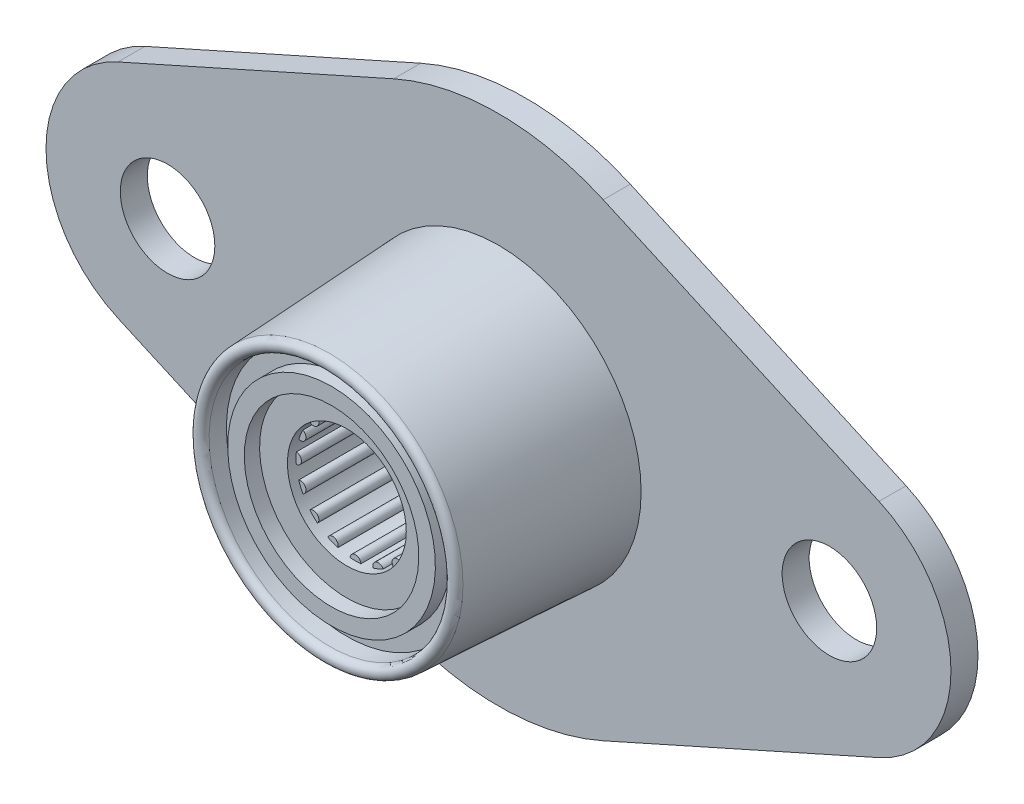
from build123d import *
from build123d.topology import SkipClean

# Parameters (mm, degrees)
SKETCH1_R          = 2.778125
SKETCH1_R_2        = 8.382
EXTRUDE1_DEPTH     = 1.5875
CUT_EXTRUDE2_DEPTH = 33.32239767
SKETCH4_R          = 3.4925
CUT_EXTRUDE3_DEPTH = 0.508
CUT_EXTRUDE4_START = -0.508
SKETCH5_R          = 3.4925
CUT_EXTRUDE4_DEPTH = 0.508


with BuildPart() as part:
    # Sketch1 → Extrude1 (new body)
    with BuildSketch(Plane.XY):
        with BuildLine():
            Line((-22.362691327, 6.521593303), (-6.155612245, 13.767808085))
            ThreePointArc((-6.155612245, 13.767808085), (0, 15.08125), (6.155612245, 13.767808085))
            Line((6.155612245, 13.767808085), (22.362691327, 6.521593303))
            ThreePointArc((22.362691327, 6.521593303), (26.590625, 0), (22.362691327, -6.521593303))
            Line((22.362691327, -6.521593303), (6.155612245, -13.767808085))
            ThreePointArc((6.155612245, -13.767808085), (0, -15.08125), (-6.155612245, -13.767808085))
            Line((-6.155612245, -13.767808085), (-22.362691327, -6.521593303))
            ThreePointArc((-22.362691327, -6.521593303), (-26.590625, 0), (-22.362691327, 6.521593303))
        make_face()
        with Locations((-19.446875, 0)):
            Circle(SKETCH1_R, mode=Mode.SUBTRACT)
        with Locations((19.446875, 0)):
            Circle(SKETCH1_R, mode=Mode.SUBTRACT)
        Circle(SKETCH1_R_2, mode=Mode.SUBTRACT)
    extrude(amount=EXTRUDE1_DEPTH)

    # Sketch2 → Revolve1 (revolve)
    with BuildSketch(Plane(origin=(0, 0, 0), x_dir=(0, 0, -1), z_dir=(1, 0, 0))):
        with BuildLine():
            Line((0, 8.382), (-1.5875, 8.382))
            Line((-1.5875, 8.382), (-11.53560961, 7.860641667))
            ThreePointArc((-11.53560961, 7.860641667), (-11.798841313, 7.73929019), (-11.90625, 7.47006819))
            ThreePointArc((-11.90625, 7.47006819), (-11.791696686, 7.193512026), (-11.515140521, 7.078958711))
            Line((-11.515140521, 7.078958711), (-10.499140521, 7.078958711))
            Line((-10.499140521, 7.078958711), (-10.499140521, 6.102969034))
            Line((-10.499140521, 6.102969034), (-11.39825, 6.102969034))
            Line((-11.39825, 6.102969034), (-11.39825, 5.126979356))
            Line((-11.39825, 5.126979356), (-10.499140521, 5.126979356))
            Line((-10.499140521, 5.126979356), (-10.499140521, 4.150989678))
            Line((-10.499140521, 4.150989678), (-10.499140521, 3.175))
            Line((-10.499140521, 3.175), (0, 3.175))
            Line((0, 3.175), (0, 8.382))
        make_face()
    revolve(axis=Axis((0, 0, 0), (0, 0, 1)))

    # Sketch3 → Cut-Extrude2 (cut, through all)
    with BuildSketch(Plane.XY.offset(10.499140521)):
        with BuildLine():
            ThreePointArc((-1.624027636, 3.0919396), (-1.940329039, 2.903907621), (-2.235091242, 2.683639952))
            ThreePointArc((-2.235091242, 2.683639952), (-2.24506403, 2.24506403), (-2.683639952, 2.235091242))
            ThreePointArc((-2.683639952, 2.235091242), (-2.903907621, 1.940329039), (-3.0919396, 1.624027636))
            ThreePointArc((-3.0919396, 1.624027636), (-2.933317516, 1.215019898), (-3.334692412, 1.037970504))
            ThreePointArc((-3.334692412, 1.037970504), (-3.425392592, 0.68135295), (-3.478068182, 0.317171835))
            ThreePointArc((-3.478068182, 0.317171835), (-3.175, 0), (-3.478068182, -0.317171835))
            ThreePointArc((-3.478068182, -0.317171835), (-3.425392592, -0.68135295), (-3.334692412, -1.037970504))
            ThreePointArc((-3.334692412, -1.037970504), (-2.933317516, -1.215019898), (-3.0919396, -1.624027636))
            ThreePointArc((-3.0919396, -1.624027636), (-2.903907621, -1.940329039), (-2.683639952, -2.235091242))
            ThreePointArc((-2.683639952, -2.235091242), (-2.24506403, -2.24506403), (-2.235091242, -2.683639952))
            ThreePointArc((-2.235091242, -2.683639952), (-1.940329039, -2.903907621), (-1.624027636, -3.0919396))
            ThreePointArc((-1.624027636, -3.0919396), (-1.215019898, -2.933317516), (-1.037970504, -3.334692412))
            ThreePointArc((-1.037970504, -3.334692412), (-0.68135295, -3.425392592), (-0.317171835, -3.478068182))
            ThreePointArc((-0.317171835, -3.478068182), (0, -3.175), (0.317171835, -3.478068182))
            ThreePointArc((0.317171835, -3.478068182), (0.68135295, -3.425392592), (1.037970504, -3.334692412))
            ThreePointArc((1.037970504, -3.334692412), (1.215019898, -2.933317516), (1.624027636, -3.0919396))
            ThreePointArc((1.624027636, -3.0919396), (1.940329039, -2.903907621), (2.235091242, -2.683639952))
            ThreePointArc((2.235091242, -2.683639952), (2.24506403, -2.24506403), (2.683639952, -2.235091242))
            ThreePointArc((2.683639952, -2.235091242), (2.903907621, -1.940329039), (3.0919396, -1.624027636))
            ThreePointArc((3.0919396, -1.624027636), (2.933317516, -1.215019898), (3.334692412, -1.037970504))
            ThreePointArc((3.334692412, -1.037970504), (3.425392592, -0.68135295), (3.478068182, -0.317171835))
            ThreePointArc((3.478068182, -0.317171835), (3.175, 0), (3.478068182, 0.317171835))
            ThreePointArc((3.478068182, 0.317171835), (3.425392592, 0.68135295), (3.334692412, 1.037970504))
            ThreePointArc((3.334692412, 1.037970504), (2.933317516, 1.215019898), (3.0919396, 1.624027636))
            ThreePointArc((3.0919396, 1.624027636), (2.903907621, 1.940329039), (2.683639952, 2.235091242))
            ThreePointArc((2.683639952, 2.235091242), (2.24506403, 2.24506403), (2.235091242, 2.683639952))
            ThreePointArc((2.235091242, 2.683639952), (1.940329039, 2.903907621), (1.624027636, 3.0919396))
            ThreePointArc((1.624027636, 3.0919396), (1.215019898, 2.933317516), (1.037970504, 3.334692412))
            ThreePointArc((1.037970504, 3.334692412), (0.68135295, 3.425392592), (0.317171835, 3.478068182))
            ThreePointArc((0.317171835, 3.478068182), (0, 3.175), (-0.317171835, 3.478068182))
            ThreePointArc((-0.317171835, 3.478068182), (-0.68135295, 3.425392592), (-1.037970504, 3.334692412))
            ThreePointArc((-1.037970504, 3.334692412), (-1.215019898, 2.933317516), (-1.624027636, 3.0919396))
        make_face()
    extrude(amount=-CUT_EXTRUDE2_DEPTH, mode=Mode.SUBTRACT)

    # Sketch4 → Cut-Extrude3 (cut)
    with BuildSketch(Plane.XY.offset(10.499140521)):
        Circle(SKETCH4_R)
    extrude(amount=-CUT_EXTRUDE3_DEPTH, mode=Mode.SUBTRACT)

    # Sketch5 → Cut-Extrude4 (cut)
    with SkipClean():  # the faces are left unmerged after this step: merging them gives an invalid solid
        with BuildSketch(Plane(origin=(0, 0, 0), x_dir=(-1, 0, 0), z_dir=(0, 0, -1)).offset(CUT_EXTRUDE4_START)):
            with Locations(Location((0, 0, 0), (0, 0, 180))):
                Circle(SKETCH5_R)
        extrude(amount=CUT_EXTRUDE4_DEPTH, mode=Mode.SUBTRACT)


solid = part.part
